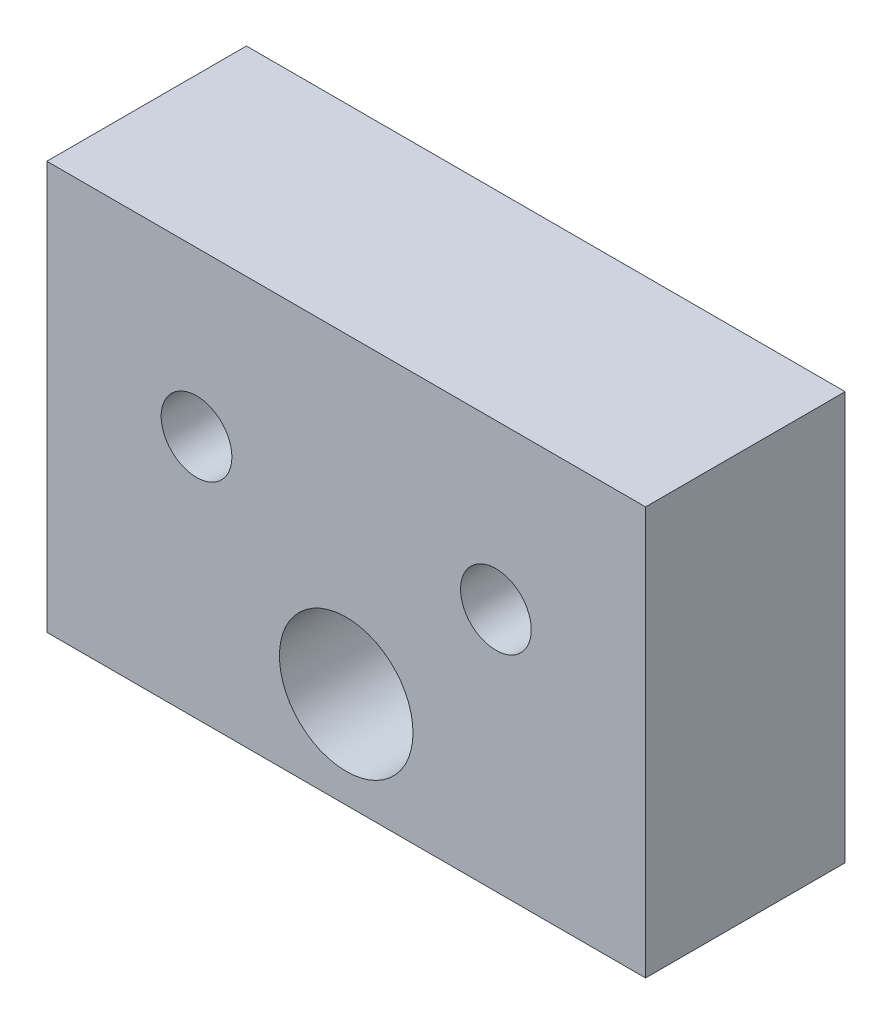
from build123d import *

# Parameters (mm, degrees)
SKETCH1_R           = 4.5
SKETCH1_R_2         = 8.5
BOSS_EXTRUDE1_DEPTH = 12.7


with BuildPart() as part:
    # Sketch1 → Boss-Extrude1 (new, symmetric)
    with BuildSketch(Plane.XY):
        Polygon((-38.1, 39.702330771), (38.1, 39.702330771), (38.1, 12.224), (38.1, -12.224), (-38.1, -12.224), (-38.1, 12.224), align=None)
        with Locations((-19.05, 18.874330771)):
            Circle(SKETCH1_R, mode=Mode.SUBTRACT)
        with Locations((19.05, 18.874330771)):
            Circle(SKETCH1_R, mode=Mode.SUBTRACT)
        Circle(SKETCH1_R_2, mode=Mode.SUBTRACT)
    extrude(amount=BOSS_EXTRUDE1_DEPTH, both=True)


solid = part.part
